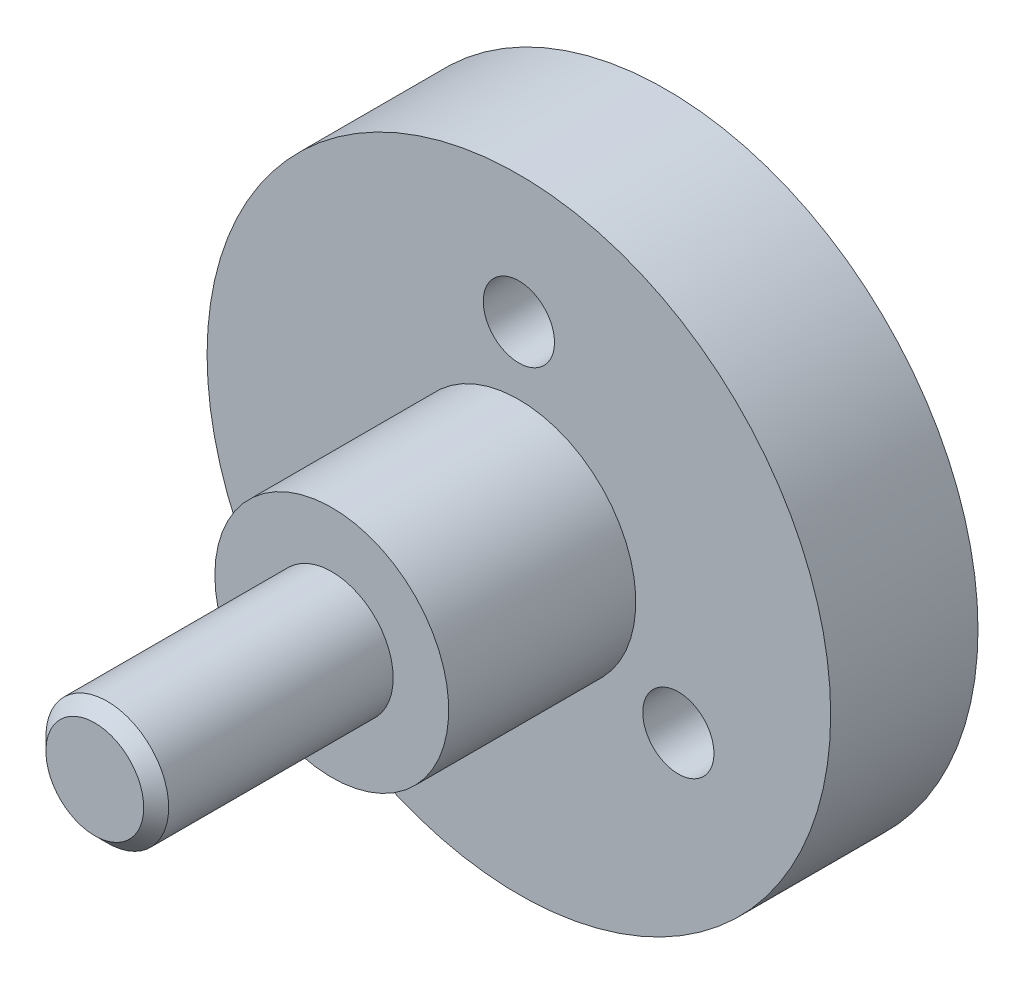
from build123d import *

# Parameters (mm, degrees)
SKETCH1_R                    = 12.7
MOUNTING_FLANGE_DEPTH        = 6
SKETCH3_R                    = 6.35
MOTOR_SHAFT_RELIEF_DEPTH     = 2.54
SKETCH4_R                    = 1.45
SCREW_CLEARANCE_HOLES_DEPTH  = 19.936208702
SKETCH2_R                    = 2.5
DRIVE_SHAFT_DEPTH            = 17.272
CHAMFER1_SIZE                = 0.508
SKETCH5_R                    = 4.7625
SHAFT_SUPPORT_SHOULDER_DEPTH = 7.62


with BuildPart() as part:
    # Sketch1 → Mounting Flange (new body)
    with BuildSketch(Plane.XY):
        Circle(SKETCH1_R)
    extrude(amount=MOUNTING_FLANGE_DEPTH)

    # Sketch3 → Motor Shaft Relief (cut)
    with BuildSketch(Plane(origin=(0, 0, 0), x_dir=(-1, 0, 0), z_dir=(0, 0, -1))):
        Circle(SKETCH3_R)
    extrude(amount=-MOTOR_SHAFT_RELIEF_DEPTH, mode=Mode.SUBTRACT)

    # Sketch4 → Screw Clearance Holes (cut, through all)
    with BuildSketch(Plane.XY.offset(6)):
        with Locations((0, 7.5)):
            Circle(SKETCH4_R)
        with Locations((6.495190528, -3.75)):
            Circle(SKETCH4_R)
        with Locations((-6.495190528, -3.75)):
            Circle(SKETCH4_R)
    extrude(amount=-SCREW_CLEARANCE_HOLES_DEPTH, mode=Mode.SUBTRACT)

    # Sketch2 → Drive Shaft (add)
    with BuildSketch(Plane.XY.offset(6)):
        Circle(SKETCH2_R)
    extrude(amount=DRIVE_SHAFT_DEPTH)

    # Chamfer1
    chamfer1_edges = [part.edges().sort_by_distance(p)[0] for p in [
        (-2.5, 0, 23.272),
    ]]
    chamfer(chamfer1_edges, length=CHAMFER1_SIZE)

    # Sketch5 → Shaft Support Shoulder (add)
    with BuildSketch(Plane.XY.offset(6)):
        with Locations(Location((0, 0, 0), (0, 0, 180))):
            Circle(SKETCH5_R)
    extrude(amount=SHAFT_SUPPORT_SHOULDER_DEPTH)


solid = part.part
